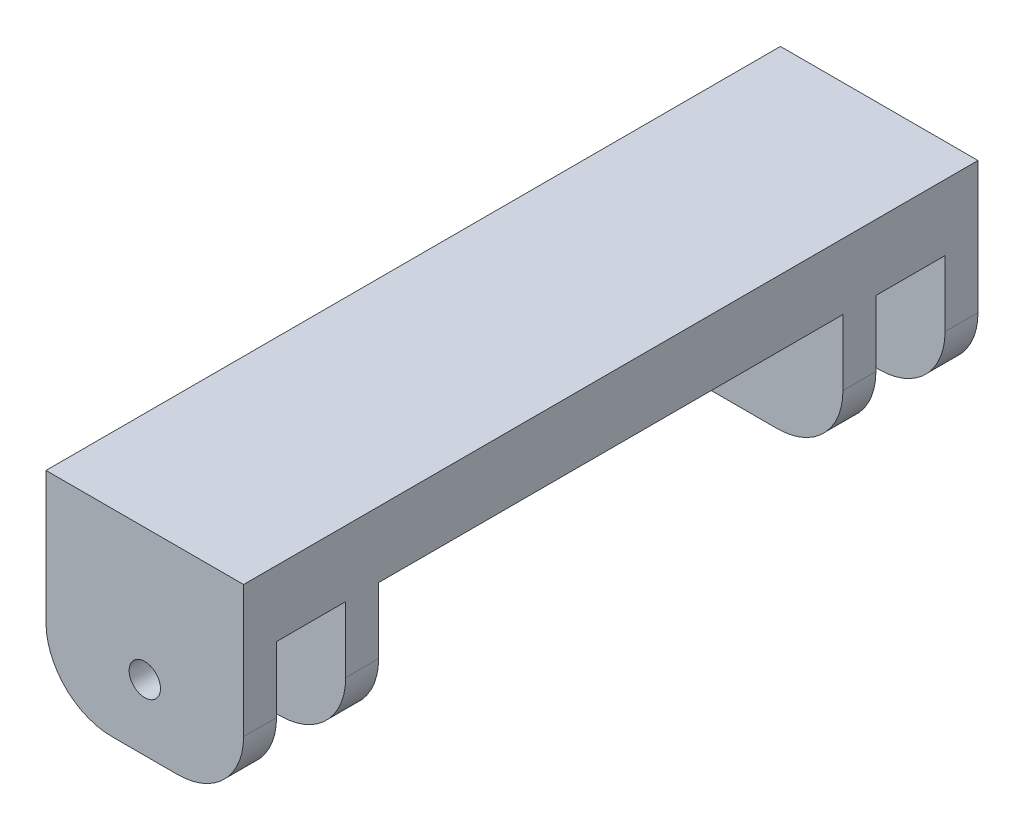
from build123d import *

# Parameters (mm, degrees)
ESQUISSE1_W                             = 30
ESQUISSE1_H                             = 10
BOSS_EXTRU_1_DEPTH                      = 111.5
ESQUISSE2_W                             = 30
ESQUISSE2_H                             = 5
BOSS_EXTRU_2_DEPTH                      = 20
PER_AGE_POUR_CROUS_AUTO_BLOQUANTS_300_D = 4.7625
CONG_1_R                                = 10


with BuildPart() as part:
    # Esquisse1 → Boss.-Extru.1 (new body)
    with BuildSketch(Plane.XY):
        with Locations((15, 5)):
            Rectangle(ESQUISSE1_W, ESQUISSE1_H)
    extrude(amount=BOSS_EXTRU_1_DEPTH)

    # Esquisse2 → Boss.-Extru.2 (add)
    with BuildSketch(Plane.XZ):
        with Locations((15, 2.5)):
            Rectangle(ESQUISSE2_W, ESQUISSE2_H)
        with Locations((15, 18)):
            Rectangle(ESQUISSE2_W, ESQUISSE2_H)
        with Locations((15, 109)):
            Rectangle(ESQUISSE2_W, ESQUISSE2_H)
        with Locations((15, 93.5)):
            Rectangle(ESQUISSE2_W, ESQUISSE2_H)
    extrude(amount=BOSS_EXTRU_2_DEPTH)

    # Perçage pour écrous auto-bloquants 300® #6 (SP)1 (through all)
    with Locations(Plane.XY.offset(111.5)):
        with Locations((15, -10)):
            Hole(PER_AGE_POUR_CROUS_AUTO_BLOQUANTS_300_D / 2)

    # Congé1
    cong_1_edges = [part.edges().sort_by_distance(p)[0] for p in [
        (0, -20, 2.5),
        (30, -20, 2.5),
        (30, -20, 18),
        (0, -20, 18),
        (0, -20, 109),
        (30, -20, 109),
        (30, -20, 93.5),
        (0, -20, 93.5),
    ]]
    fillet(cong_1_edges, radius=CONG_1_R)


solid = part.part
